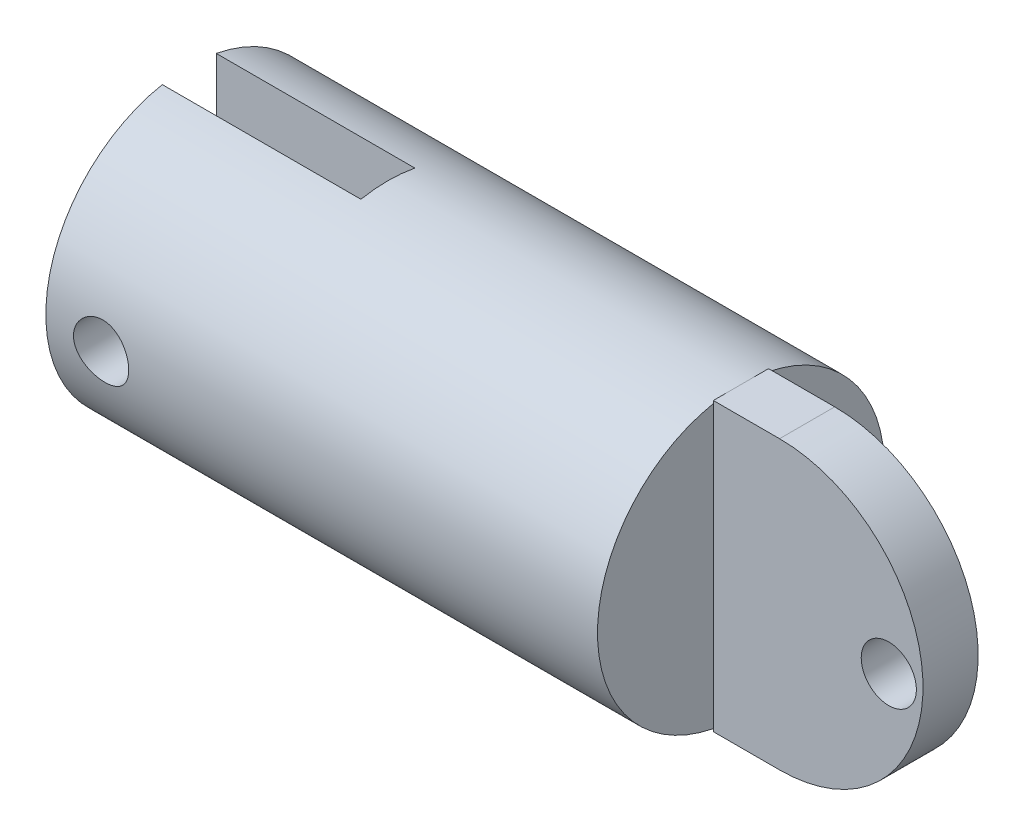
from build123d import *

# Parameters (mm, degrees)
SKETCH1_R               = 13
BOSS_EXTRUDE1_DEPTH     = 50
SKETCH6_W               = 5
SKETCH6_H               = 26
BOSS_EXTRUDE3_DEPTH     = 6
BOSS_EXTRUDE4_DEPTH     = 5
CUT_EXTRUDE1_DEPTH      = 54.937463789
CUT_EXTRUDE1_DEPTH_BACK = 54.937463789
SKETCH10_R              = 2.5
SKETCH12_W              = 4.8936145
SKETCH12_H              = 26
CUT_EXTRUDE2_DEPTH      = 18
CUT_EXTRUDE3_DEPTH      = 54.272882407
CUT_EXTRUDE3_DEPTH_BACK = 54.272882407
SKETCH13_R              = 2.5


with BuildPart() as part:
    # Sketch1 → Boss-Extrude1 (new body)
    with BuildSketch(Plane(origin=(0, 0, 0), x_dir=(0, 0, -1), z_dir=(1, 0, 0))):
        Circle(SKETCH1_R)
    extrude(amount=-BOSS_EXTRUDE1_DEPTH)

    # Sketch6 → Boss-Extrude3 (add)
    with BuildSketch(Plane(origin=(0, 0, 0), x_dir=(0, 0, -1), z_dir=(1, 0, 0))):
        Rectangle(SKETCH6_W, SKETCH6_H)
    extrude(amount=BOSS_EXTRUDE3_DEPTH)

    # Sketch8 → Boss-Extrude4 (add)
    with BuildSketch(Plane.XY.offset(2.5)):
        with BuildLine():
            Line((6, 13), (6, -13))
            ThreePointArc((6, -13), (19, 0), (6, 13))
        make_face()
    extrude(amount=-BOSS_EXTRUDE4_DEPTH)

    # Sketch10 → Cut-Extrude1 (cut, two sides: drawn at the far end of the back side and taken through both)
    with BuildSketch(Plane.XY.offset(2.5).offset(-CUT_EXTRUDE1_DEPTH_BACK)):
        with Locations((15.9, -0.5)):
            Circle(SKETCH10_R)
    extrude(amount=CUT_EXTRUDE1_DEPTH + CUT_EXTRUDE1_DEPTH_BACK, mode=Mode.SUBTRACT)

    # Sketch12 → Cut-Extrude2 (cut)
    with BuildSketch(Plane.ZY.offset(50)):
        Rectangle(SKETCH12_W, SKETCH12_H)
    extrude(amount=-CUT_EXTRUDE2_DEPTH, mode=Mode.SUBTRACT)

    # Sketch13 → Cut-Extrude3 (cut, two sides: drawn at the far end of the back side and taken through both)
    with BuildSketch(Plane.XY.offset(-CUT_EXTRUDE3_DEPTH_BACK)):
        with Locations(Location((-45, -0.5, 0), (0, 0, 168.463040967))):
            Circle(SKETCH13_R)
    extrude(amount=CUT_EXTRUDE3_DEPTH + CUT_EXTRUDE3_DEPTH_BACK, mode=Mode.SUBTRACT)


solid = part.part
